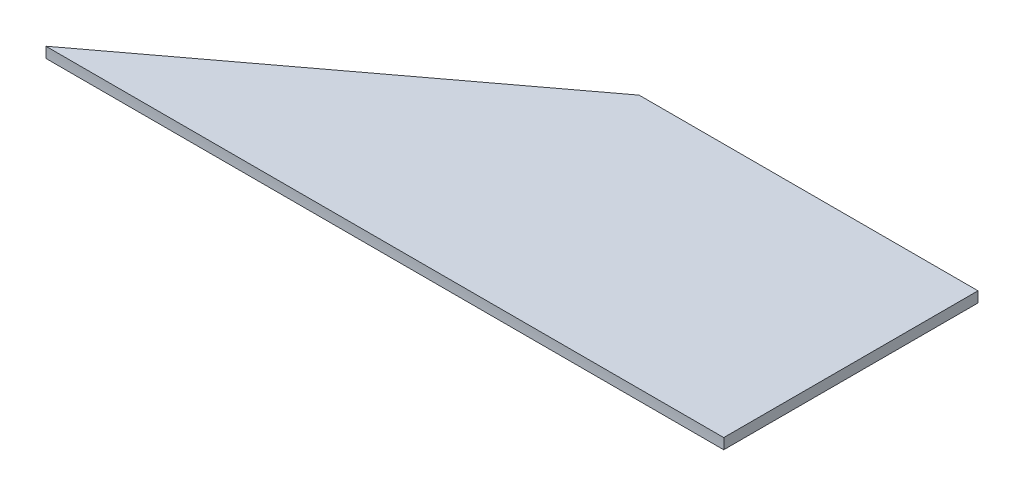
from build123d import *

# Parameters (mm, degrees)
BOSS_EXTRUDE1_DEPTH = 1.5875
BOSS_EXTRUDE2_DEPTH = 101.6


with BuildPart() as part:
    # Sketch1 → Boss-Extrude1 (new, symmetric)
    with BuildSketch(Plane(origin=(0, 0, 0), x_dir=(1, 0, 0), z_dir=(0, 1, 0))):
        Polygon((-101.6, 0), (101.6, 0), (101.6, 76.2), (0, 76.2), align=None)
    extrude(amount=BOSS_EXTRUDE1_DEPTH, both=True)

    # Sketch2 → Boss-Extrude2 (add, symmetric)
    with BuildSketch(Plane(origin=(0, 0, 0), x_dir=(0, 0, -1), z_dir=(1, 0, 0))):
        with BuildLine():
            ThreePointArc((-0.007951018, -0.79375), (-0.017893832, -1.190684781), (-0.031813653, -1.5875))
            Line((-0.031813653, -1.5875), (0, -1.5875))
            Line((0, -1.5875), (-0.007951018, -0.79375))
        make_face()
        with BuildLine():
            Line((0, -1.5875), (0, 0))
            ThreePointArc((0, 0), (-0.001987804, -0.396894911), (-0.007951018, -0.79375))
            Line((-0.007951018, -0.79375), (0, -1.5875))
        make_face()
        with BuildLine():
            Line((0, 0), (0, 1.5875))
            Line((0, 1.5875), (-0.031813653, 1.5875))
            ThreePointArc((-0.031813653, 1.5875), (-0.007954212, 0.793909371), (0, 0))
        make_face()
    extrude(amount=BOSS_EXTRUDE2_DEPTH, both=True)


solid = part.part
